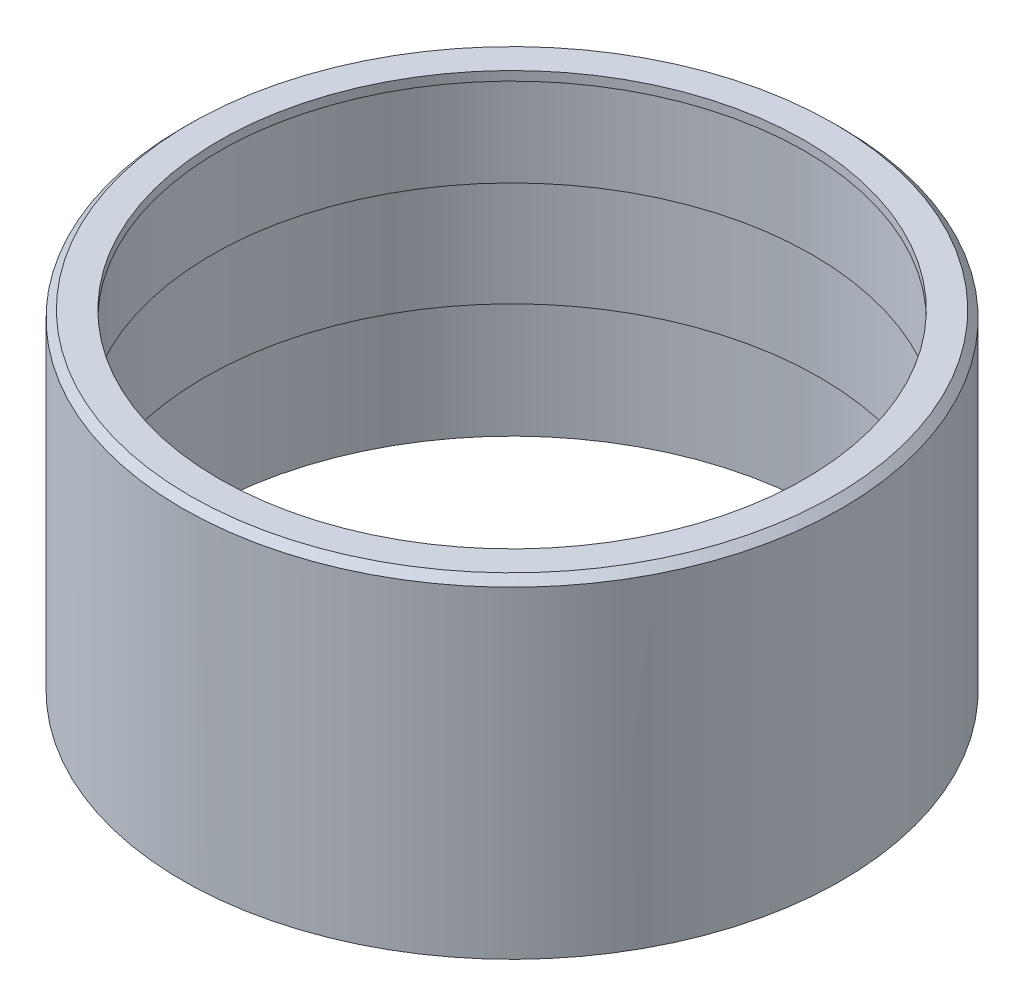
from build123d import *

# Parameters (mm, degrees)
CHAMFER1_SIZE       = 0.508
CHAMFER2_SIZE       = 0.254
BOSS_EXTRUDE1_REACH = 41.595
SKETCH2_R           = 22.86
SKETCH2_R_2         = 21.59


with BuildPart() as part:
    # Sketch1 → Revolve1 (revolve)
    with BuildSketch(Plane.XY, mode=Mode.PRIVATE) as revolve1_sk:
        Polygon((20.32, 22.225), (20.32, 22.86), (22.86, 22.86), (22.86, 0), (22.225, 0), (22.225, 2.413), (21.59, 2.413), (21.59, 5.588), (21.59, 8.128), (21.336, 8.128), (21.336, 15.748), (20.828, 15.748), (20.828, 21.59), (20.828, 22.225), align=None)
    revolve(revolve1_sk.sketch.rotate(Axis((0, -7.741318897, 0), (0, 1, 0)), 90), axis=Axis((0, -7.741318897, 0), (0, 1, 0)))

    # Chamfer1
    chamfer1_edges = [part.edges().sort_by_distance(p)[0] for p in [
        (0, 22.86, 22.86),
    ]]
    chamfer(chamfer1_edges, length=CHAMFER1_SIZE)

    # Chamfer2
    chamfer2_edges = [part.edges().sort_by_distance(p)[0] for p in [
        (0, 0, 22.225),
    ]]
    chamfer(chamfer2_edges, length=CHAMFER2_SIZE)

    # Sketch2 → Boss-Extrude1 (add, up to next)
    with BuildSketch(Plane.XZ, mode=Mode.PRIVATE) as boss_extrude1_sk1:
        with Locations(Location((0, 0, 0), (0, 0, 270))):
            Circle(SKETCH2_R)
        with Locations(Location((0, 0, 0), (0, 0, 270))):
            Circle(SKETCH2_R_2, mode=Mode.SUBTRACT)
    boss_extrude1_tool1 = extrude(boss_extrude1_sk1.sketch, amount=-BOSS_EXTRUDE1_REACH, mode=Mode.PRIVATE) - part.part
    add(boss_extrude1_tool1.solids().sort_by_distance((0, 0, 22.213422))[0])


solid = part.part
